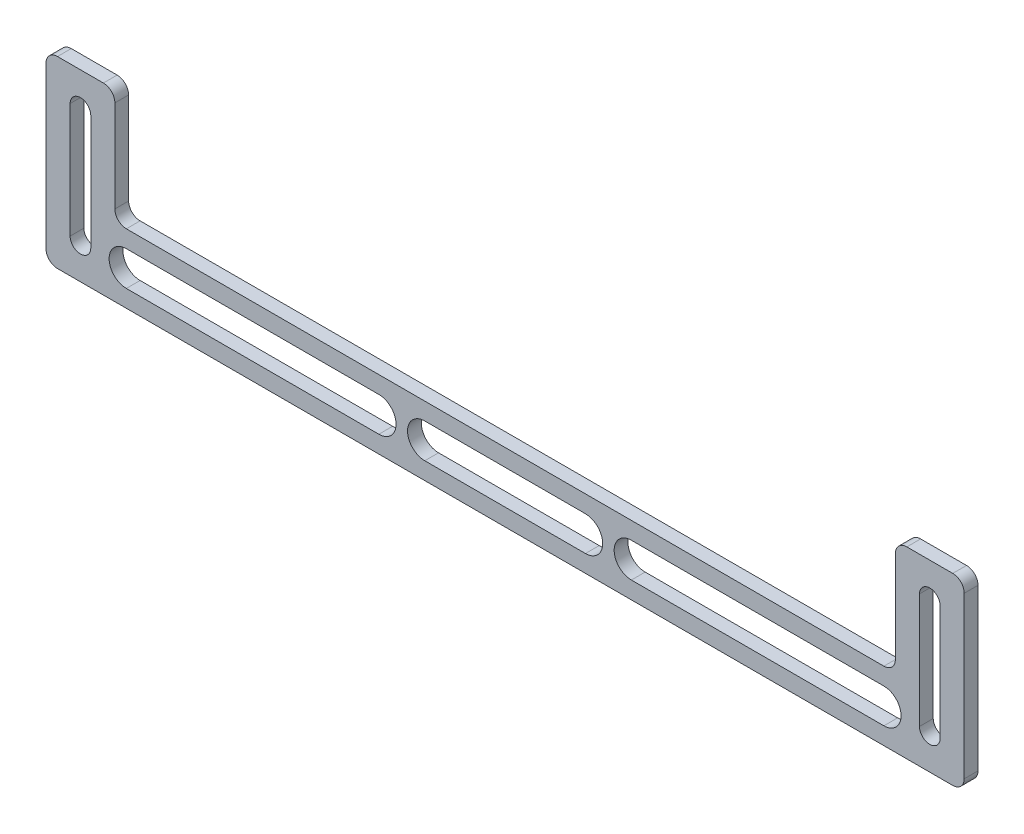
from build123d import *

# Parameters (mm, degrees)
EXTRUDE_1_DEPTH = 6
FILLET_1_R      = 5


with BuildPart() as part:
    # 草图1 → 凸台-拉伸1 (new body)
    with BuildSketch(Plane.XY):
        Polygon((-170, 15), (170, 15), (170, 65), (200, 65), (200, -15), (-200, -15), (-200, 65), (-170, 65), align=None)
        with BuildLine():
            Line((-35, 7.5), (35, 7.5))
            ThreePointArc((35, 7.5), (42.5, 0), (35, -7.5))
            Line((35, -7.5), (-35, -7.5))
            ThreePointArc((-35, -7.5), (-42.5, 0), (-35, 7.5))
        make_face(mode=Mode.SUBTRACT)
        with BuildLine():
            Line((55, 7.5), (165, 7.5))
            ThreePointArc((165, 7.5), (172.5, 0), (165, -7.5))
            Line((165, -7.5), (55, -7.5))
            ThreePointArc((55, -7.5), (47.5, 0), (55, 7.5))
        make_face(mode=Mode.SUBTRACT)
        with BuildLine():
            Line((189.5, 50), (189.5, 0))
            ThreePointArc((189.5, 0), (185, -4.5), (180.5, 0))
            Line((180.5, 0), (180.5, 50))
            ThreePointArc((180.5, 50), (185, 54.5), (189.5, 50))
        make_face(mode=Mode.SUBTRACT)
        with BuildLine():
            Line((-189.5, 50), (-189.5, 0))
            ThreePointArc((-189.5, 0), (-185, -4.5), (-180.5, 0))
            Line((-180.5, 0), (-180.5, 50))
            ThreePointArc((-180.5, 50), (-185, 54.5), (-189.5, 50))
        make_face(mode=Mode.SUBTRACT)
        with BuildLine():
            Line((-55, 7.5), (-165, 7.5))
            ThreePointArc((-165, 7.5), (-172.5, 0), (-165, -7.5))
            Line((-165, -7.5), (-55, -7.5))
            ThreePointArc((-55, -7.5), (-47.5, 0), (-55, 7.5))
        make_face(mode=Mode.SUBTRACT)
    extrude(amount=EXTRUDE_1_DEPTH)

    # 圆角1
    fillet_1_edges = [part.edges().sort_by_distance(p)[0] for p in [
        (170, 65, 3),
        (200, 65, 3),
        (200, -15, 3),
        (-200, -15, 3),
        (-200, 65, 3),
        (-170, 65, 3),
        (-170, 15, 3),
        (170, 15, 3),
    ]]
    fillet(fillet_1_edges, radius=FILLET_1_R)


solid = part.part
